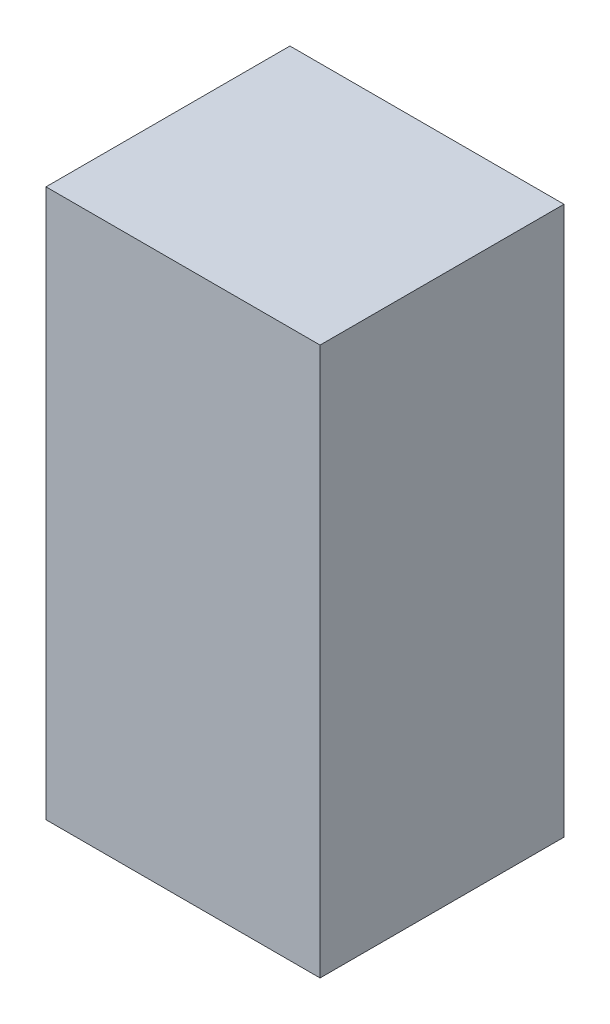
from build123d import *

# Parameters (mm, degrees)
SKETCH_1_W      = 20
SKETCH_1_H      = 40
EXTRUDE_1_DEPTH = 17.8


with BuildPart() as part:
    # 草图1 → 凸台-拉伸1 (new body)
    with BuildSketch(Plane.XY):
        Rectangle(SKETCH_1_W, SKETCH_1_H)
    extrude(amount=EXTRUDE_1_DEPTH)


solid = part.part
